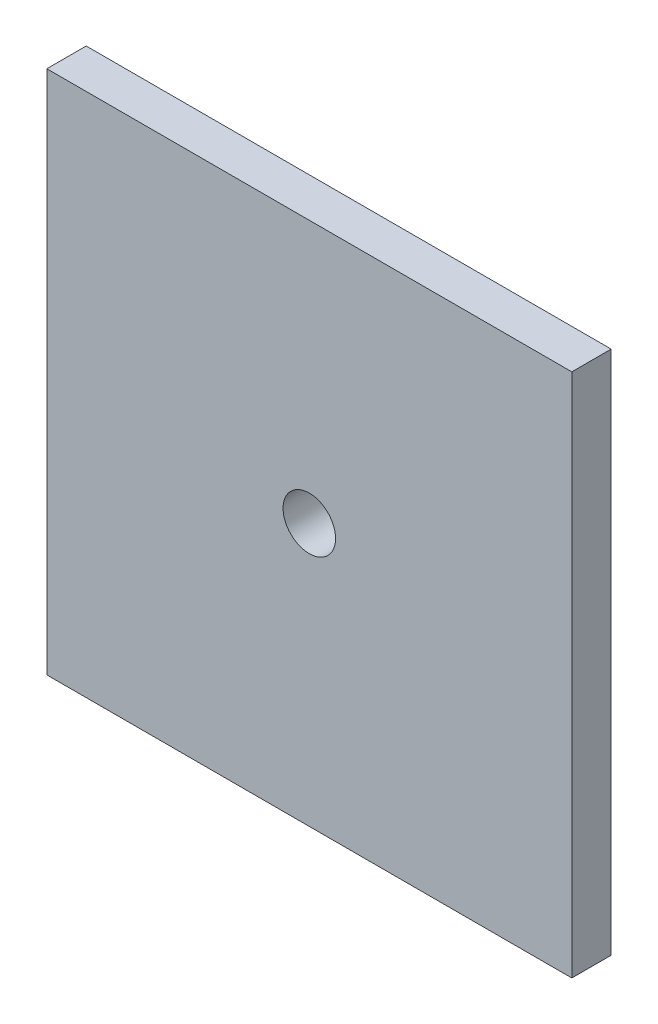
from build123d import *

# Parameters (mm, degrees)
SKETCH1_W           = 80
SKETCH1_H           = 80
BOSS_EXTRUDE1_DEPTH = 6
SKETCH2_R           = 4
CUT_EXTRUDE1_DEPTH  = 6


with BuildPart() as part:
    # Sketch1 → Boss-Extrude1 (new body)
    with BuildSketch(Plane.XY):
        Rectangle(SKETCH1_W, SKETCH1_H)
    extrude(amount=BOSS_EXTRUDE1_DEPTH)

    # Sketch2 → Cut-Extrude1 (cut)
    with BuildSketch(Plane.XY.offset(6)):
        Circle(SKETCH2_R)
    extrude(amount=-CUT_EXTRUDE1_DEPTH, mode=Mode.SUBTRACT)


solid = part.part
